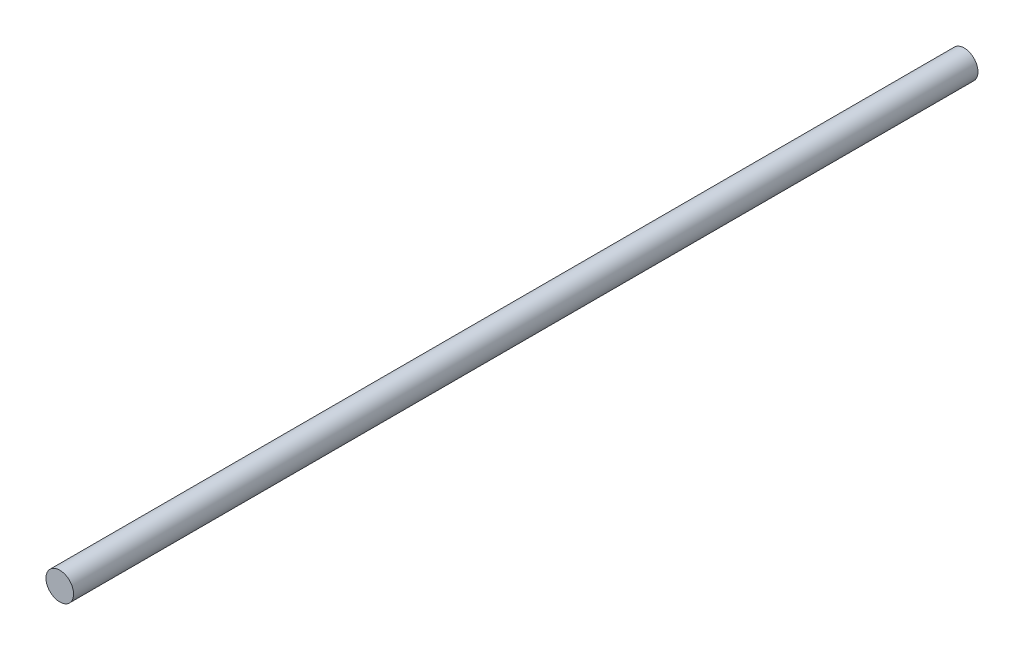
from build123d import *

# Parameters (mm, degrees)
SKETCH1_R           = 5
BOSS_EXTRUDE1_DEPTH = 328


with BuildPart() as part:
    # Sketch1 → Boss-Extrude1 (new body)
    with BuildSketch(Plane.XY):
        Circle(SKETCH1_R)
    extrude(amount=BOSS_EXTRUDE1_DEPTH)


solid = part.part
